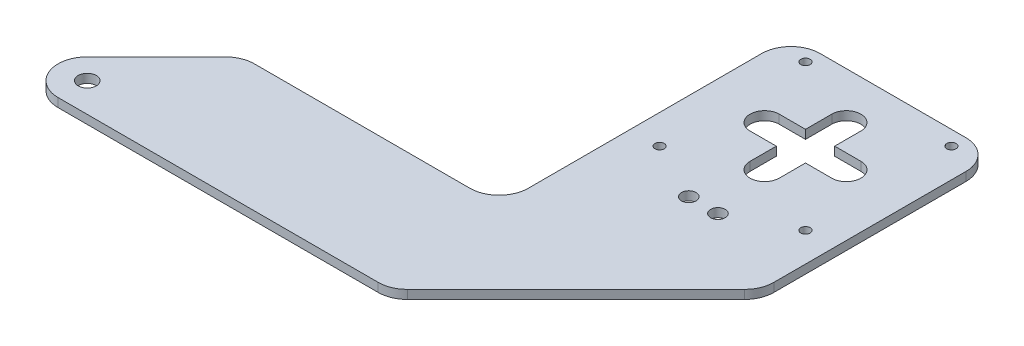
from build123d import *

# Parameters (mm, degrees)
SKETCH_1_W          = 70
SKETCH_1_H          = 60
SKETCH_1_R          = 1.6
EXTRUDE_1_DEPTH     = 3
EXTRUDE_2_DEPTH     = 3
FILLET_1_R          = 10
FILLET_3_R          = 10
SKETCH_4_R          = 3.1
CUT_EXTRUDE_1_DEPTH = 10
SKETCH_5_R          = 2.5
CUT_EXTRUDE_2_DEPTH = 156.311257048


with BuildPart() as part:
    # 草图1 → 凸台-拉伸1 (new body)
    with BuildSketch(Plane(origin=(0, 0, 0), x_dir=(1, 0, 0), z_dir=(0, 1, 0))):
        with Locations((25, 25)):
            Rectangle(SKETCH_1_W, SKETCH_1_H)
        with Locations(Location((0, 50, 0), (0, 0, 270))):
            Circle(SKETCH_1_R, mode=Mode.SUBTRACT)
        with Locations(Location((50, 50, 0), (0, 0, 90))):
            Circle(SKETCH_1_R, mode=Mode.SUBTRACT)
        with Locations(Location((50, 0, 0), (0, 0, 270))):
            Circle(SKETCH_1_R, mode=Mode.SUBTRACT)
        with Locations(Location((0, 0, 0), (0, 0, 90))):
            Circle(SKETCH_1_R, mode=Mode.SUBTRACT)
    extrude(amount=EXTRUDE_1_DEPTH)

    # 草图2 → 凸台-拉伸2 (add)
    with BuildSketch(Plane(origin=(0, 0, 0), x_dir=(1, 0, 0), z_dir=(0, 1, 0))):
        Polygon((-10, -5), (60, -5), (60, -25), (-3.639610307, -88.639610307), (-58.172444533, -88.639610307), (-141.639610307, -88.639610307), (-98, -45), (-10, -45), align=None)
    extrude(amount=EXTRUDE_2_DEPTH)

    # 圆角1
    fillet_1_edges = [part.edges().sort_by_distance(p)[0] for p in [
        (-10, 1.5, 45),
        (-3.639610307, 1.5, 88.639610307),
        (60, 1.5, 25),
        (-10, 1.5, -55),
        (60, 1.5, -55),
    ]]
    fillet(fillet_1_edges, radius=FILLET_1_R)

    # 圆角3
    fillet_3_edges = [part.edges().sort_by_distance(p)[0] for p in [
        (-98, 1.5, 45),
        (-141.639610307, 1.5, 88.639610307),
    ]]
    fillet(fillet_3_edges, radius=FILLET_3_R)

    # 草图4 → 切除-拉伸1 (cut)
    with BuildSketch(Plane(origin=(0, 3, 0), x_dir=(1, 0, 0), z_dir=(0, 1, 0))):
        with Locations(Location((-117.497474683, -78.639610307, 0), (0, 0, 270))):
            Circle(SKETCH_4_R)
    extrude(amount=-CUT_EXTRUDE_1_DEPTH, mode=Mode.SUBTRACT)

    # 草图5 → 切除-拉伸2 (cut, through all)
    with BuildSketch(Plane(origin=(0, 3, 0), x_dir=(1, 0, 0), z_dir=(0, 1, 0))):
        with Locations(Location((20, -10, 0), (0, 0, 270))):
            Circle(SKETCH_5_R)
        with Locations(Location((30, -10, 0), (0, 0, 90))):
            Circle(SKETCH_5_R)
        with BuildLine():
            Line((11, 30), (20, 30))
            Line((20, 30), (20, 39))
            ThreePointArc((20, 39), (25, 44), (30, 39))
            Line((30, 39), (30, 30))
            Line((30, 30), (39, 30))
            ThreePointArc((39, 30), (44, 25), (39, 20))
            Line((39, 20), (30, 20))
            Line((30, 20), (30, 11))
            ThreePointArc((30, 11), (25, 6), (20, 11))
            Line((20, 11), (20, 20))
            Line((20, 20), (11, 20))
            ThreePointArc((11, 20), (6, 25), (11, 30))
        make_face()
    extrude(amount=-CUT_EXTRUDE_2_DEPTH, mode=Mode.SUBTRACT)


solid = part.part
